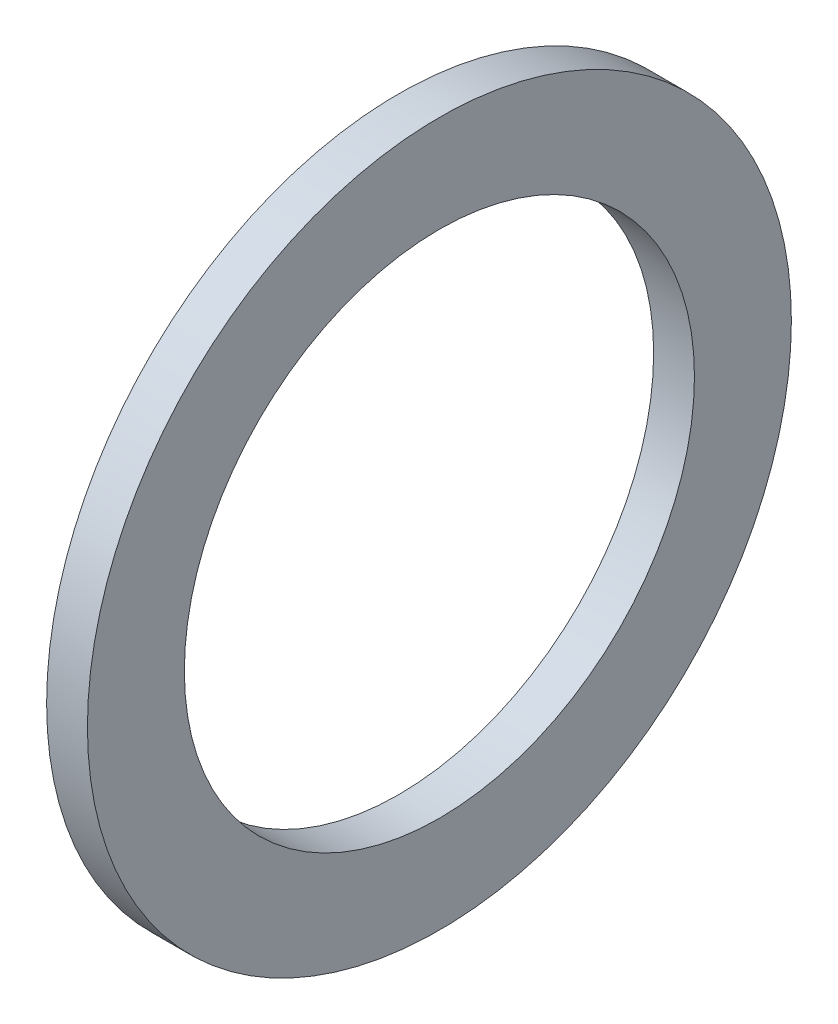
from build123d import *

# Parameters (mm, degrees)
SKETCH1_R           = 8.763
SKETCH1_R_2         = 6.35
BOSS_EXTRUDE1_DEPTH = 1.016


with BuildPart() as part:
    # Sketch1 → Boss-Extrude1 (new body)
    with BuildSketch(Plane(origin=(0, 0, 0), x_dir=(0, 0, -1), z_dir=(1, 0, 0))):
        Circle(SKETCH1_R)
        Circle(SKETCH1_R_2, mode=Mode.SUBTRACT)
    extrude(amount=BOSS_EXTRUDE1_DEPTH)


solid = part.part
